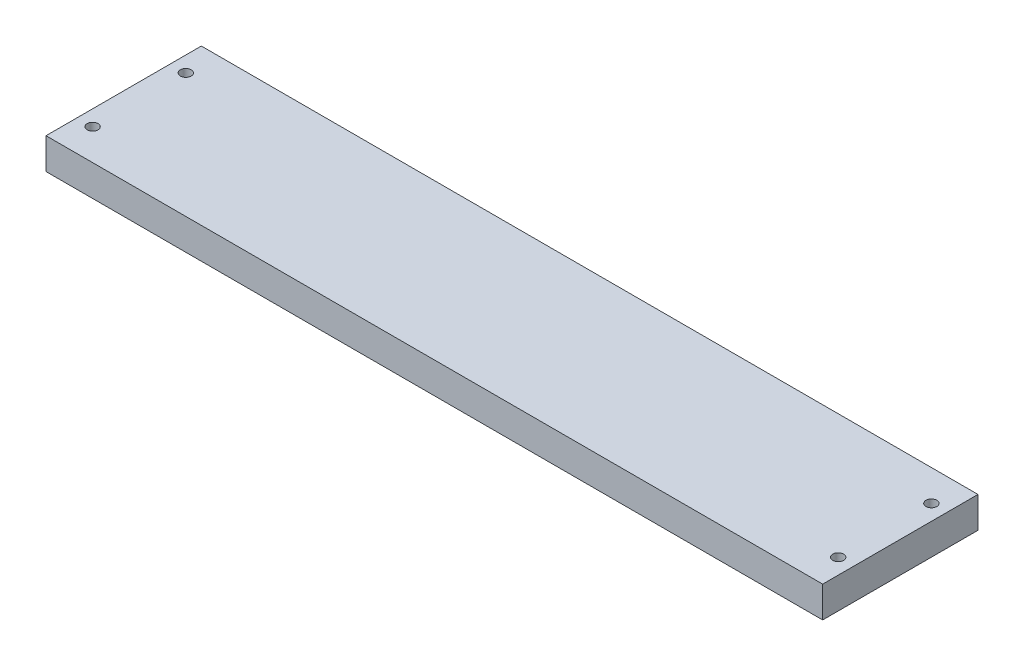
from build123d import *

# Parameters (mm, degrees)
SKETCH1_W           = 250
SKETCH1_H           = 50
SKETCH1_R           = 1.75
BOSS_EXTRUDE1_DEPTH = 10


with BuildPart() as part:
    # Sketch1 → Boss-Extrude1 (new body)
    with BuildSketch(Plane(origin=(0, 0, 0), x_dir=(1, 0, 0), z_dir=(0, 1, 0))):
        with Locations((125, 25)):
            Rectangle(SKETCH1_W, SKETCH1_H)
        with Locations(Location((5, 40, 0), (0, 0, 270))):
            Circle(SKETCH1_R, mode=Mode.SUBTRACT)
        with Locations(Location((5, 10, 0), (0, 0, 270))):
            Circle(SKETCH1_R, mode=Mode.SUBTRACT)
        with Locations(Location((245, 10, 0), (0, 0, 270))):
            Circle(SKETCH1_R, mode=Mode.SUBTRACT)
        with Locations(Location((245, 40, 0), (0, 0, 270))):
            Circle(SKETCH1_R, mode=Mode.SUBTRACT)
    extrude(amount=BOSS_EXTRUDE1_DEPTH)


solid = part.part
